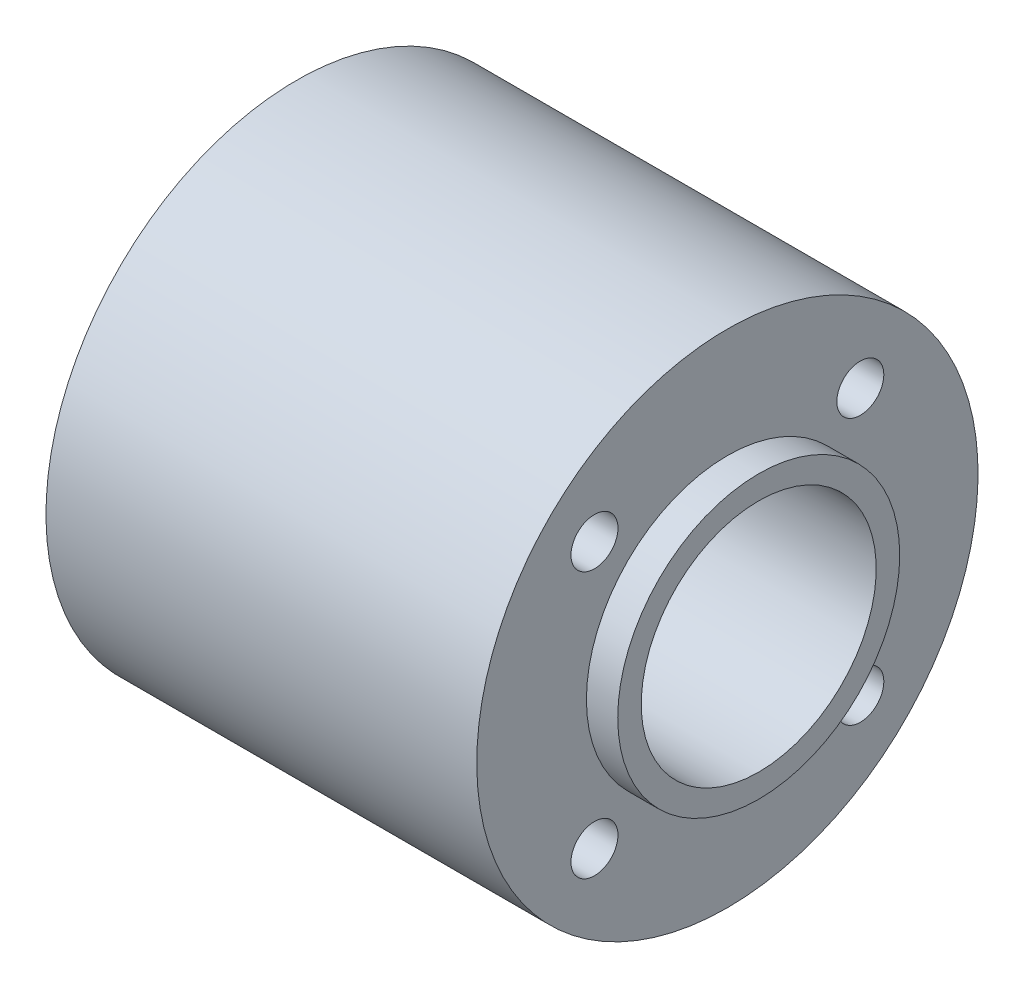
from build123d import *

# Parameters (mm, degrees)
CUT_EXTRUDE1_DEPTH      = 39.784661917
CUT_EXTRUDE1_DEPTH_BACK = 39.784661917
SKETCH2_R               = 7.5
CUT_EXTRUDE2_DEPTH      = 38.17862289
CUT_EXTRUDE2_DEPTH_BACK = 38.17862289
SKETCH3_R               = 1.5


with BuildPart() as part:
    # Sketch1 → Revolve1 (revolve)
    with BuildSketch(Plane.XY, mode=Mode.PRIVATE) as revolve1_sk:
        Polygon((15.75, 0), (15.75, 9), (13.75, 9), (13.75, 16), (-13.75, 16), (-13.75, 9), (-15.75, 9), (-15.75, 0), align=None)
    revolve(revolve1_sk.sketch.rotate(Axis((-15.75, 0, 0), (1, 0, 0)), 180), axis=Axis((-15.75, 0, 0), (1, 0, 0)))

    # Sketch2 → Cut-Extrude1 (cut, two sides: drawn at the far end of the back side and taken through both)
    with BuildSketch(Plane(origin=(15.75, 0, 0), x_dir=(0, 0, -1), z_dir=(1, 0, 0)).offset(-CUT_EXTRUDE1_DEPTH_BACK)):
        with Locations(Location((0, 0, 0), (0, 0, 90))):
            Circle(SKETCH2_R)
    extrude(amount=CUT_EXTRUDE1_DEPTH + CUT_EXTRUDE1_DEPTH_BACK, mode=Mode.SUBTRACT)

    # Sketch3 → Cut-Extrude2 (cut, two sides: drawn at the far end of the back side and taken through both)
    with BuildSketch(Plane(origin=(13.75, 0, 0), x_dir=(0, 0, -1), z_dir=(1, 0, 0)).offset(-CUT_EXTRUDE2_DEPTH_BACK)):
        with Locations(Location((-8.485281374, 8.485281374, 0), (0, 0, 90))):
            Circle(SKETCH3_R)
        with Locations(Location((8.485281374, 8.485281374, 0), (0, 0, 90))):
            Circle(SKETCH3_R)
        with Locations(Location((8.485281374, -8.485281374, 0), (0, 0, 90))):
            Circle(SKETCH3_R)
        with Locations(Location((-8.485281374, -8.485281374, 0), (0, 0, 90))):
            Circle(SKETCH3_R)
    extrude(amount=CUT_EXTRUDE2_DEPTH + CUT_EXTRUDE2_DEPTH_BACK, mode=Mode.SUBTRACT)


solid = part.part
